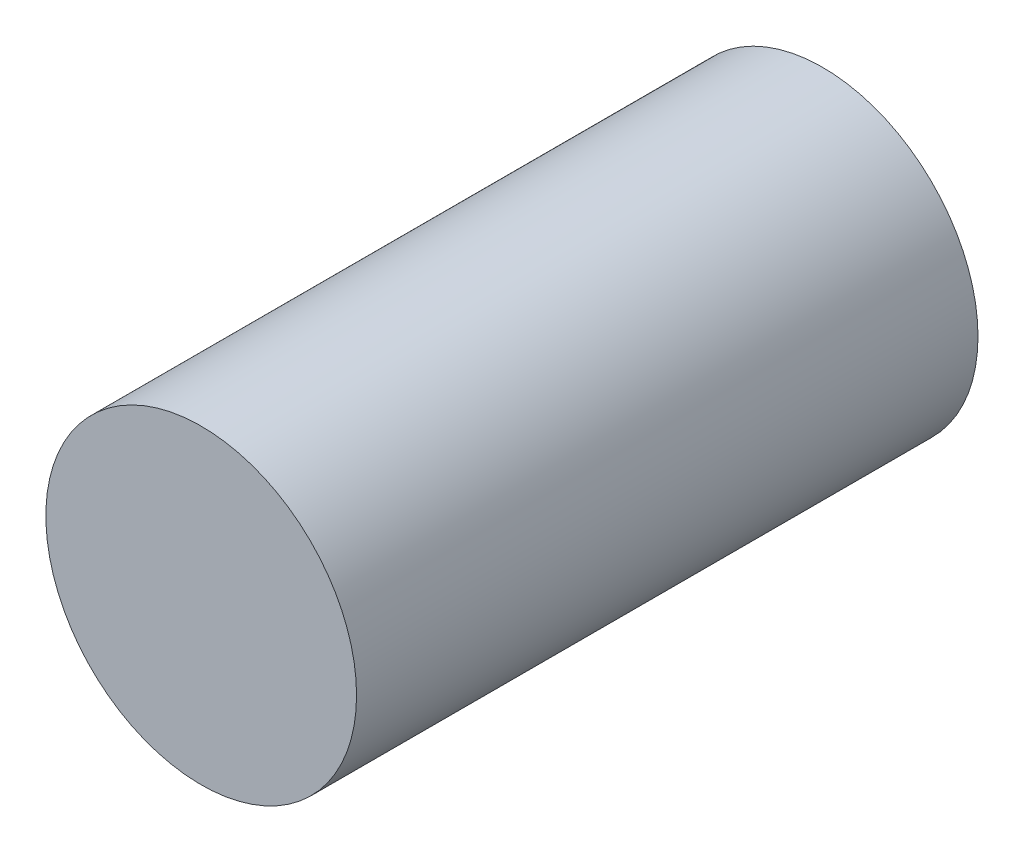
from build123d import *

# Parameters (mm, degrees)
ESBO_O1_R                = 50
RESSALTO_EXTRUS_O1_DEPTH = 200


with BuildPart() as part:
    # Esboço1 → Ressalto-extrusão1 (new body)
    with BuildSketch(Plane.XY):
        Circle(ESBO_O1_R)
    extrude(amount=RESSALTO_EXTRUS_O1_DEPTH)


solid = part.part
